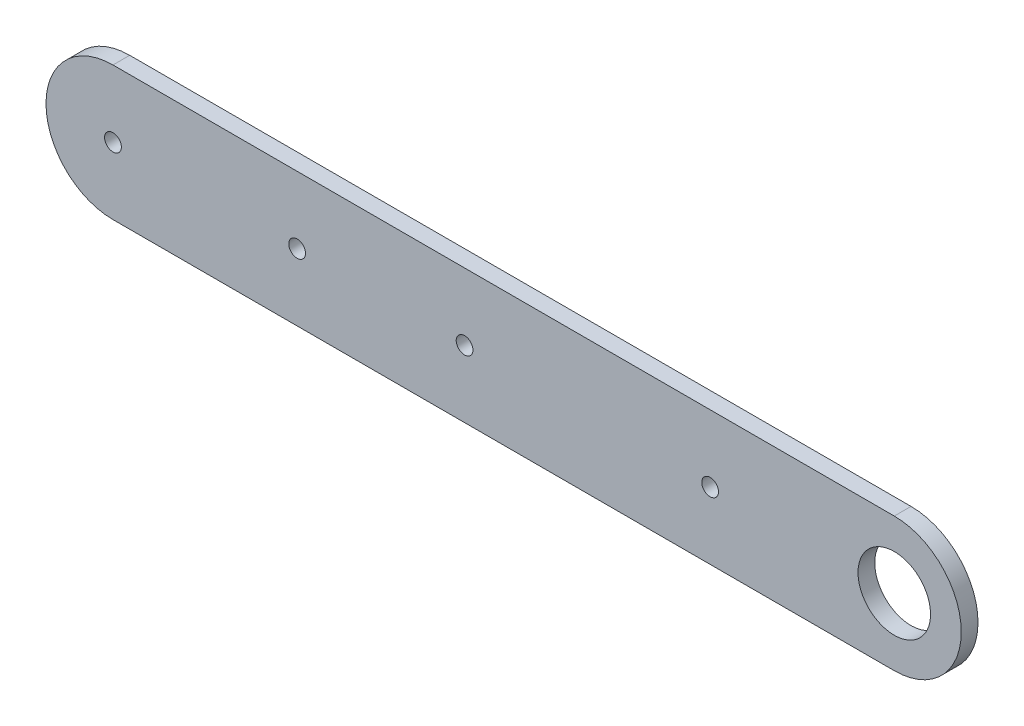
from build123d import *

# Parameters (mm, degrees)
ESQUISSE1_R        = 1.5
ESQUISSE1_R_2      = 6.5
BOSS_EXTRU_1_DEPTH = 3


with BuildPart() as part:
    # Esquisse1 → Boss.-Extru.1 (new body)
    with BuildSketch(Plane.XY):
        with BuildLine():
            Line((-70, 12), (70, 12))
            ThreePointArc((70, 12), (82, 0), (70, -12))
            Line((70, -12), (-70, -12))
            ThreePointArc((-70, -12), (-82, 0), (-70, 12))
        make_face()
        with Locations((-7, 0)):
            Circle(ESQUISSE1_R, mode=Mode.SUBTRACT)
        with Locations((-70, 0)):
            Circle(ESQUISSE1_R, mode=Mode.SUBTRACT)
        with Locations(Location((70, 0, 0), (0, 0, 180))):
            Circle(ESQUISSE1_R_2, mode=Mode.SUBTRACT)
        with Locations((-37, 0)):
            Circle(ESQUISSE1_R, mode=Mode.SUBTRACT)
        with Locations((37, 0)):
            Circle(ESQUISSE1_R, mode=Mode.SUBTRACT)
    extrude(amount=BOSS_EXTRU_1_DEPTH)


solid = part.part
